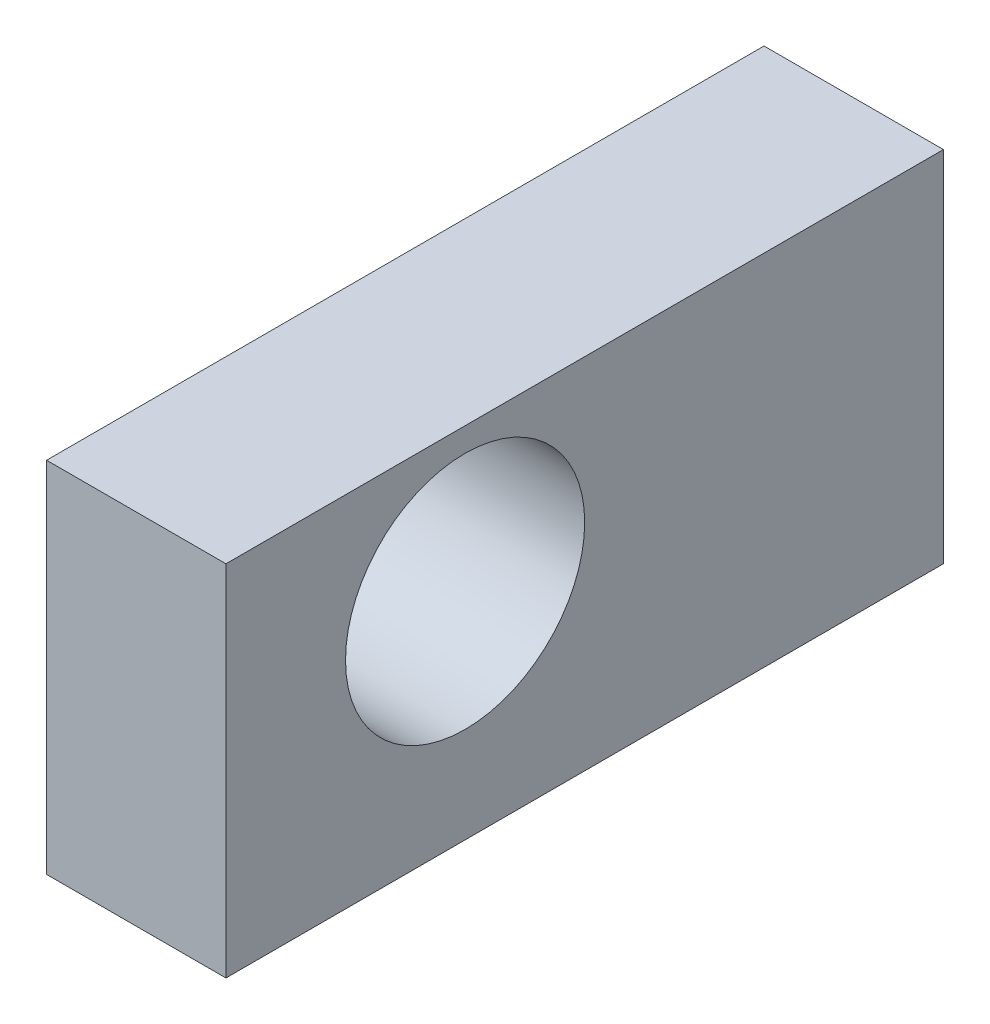
from build123d import *

# Parameters (mm, degrees)
SKETCH1_W                      = 38.1
SKETCH1_H                      = 19.05
BOSS_EXTRUDE1_DEPTH            = 9.525
F_1_2_0_5_DIAMETER_HOLE1_D     = 12.7
F_1_2_0_5_DIAMETER_HOLE1_DEPTH = 70.104
F_1_2_0_5_DIAMETER_HOLE1_TIP   = 3.815464931
F_10_32_TAPPED_HOLE1_D         = 4.0386
F_10_32_TAPPED_HOLE1_DEPTH     = 11.938
F_10_32_TAPPED_HOLE1_TIP       = 1.213317848


with BuildPart() as part:
    # Sketch1 → Boss-Extrude1 (new body)
    with BuildSketch(Plane(origin=(0, 0, 0), x_dir=(0, 0, -1), z_dir=(1, 0, 0))):
        Rectangle(SKETCH1_W, SKETCH1_H)
    extrude(amount=BOSS_EXTRUDE1_DEPTH)

    # 1/2 (0.5) Diameter Hole1
    with Locations(Plane(origin=(9.525, 0, 0), x_dir=(0, 0, -1), z_dir=(1, 0, 0))):
        with Locations((-6.35, 1.905)):
            Hole(F_1_2_0_5_DIAMETER_HOLE1_D / 2, depth=F_1_2_0_5_DIAMETER_HOLE1_DEPTH)
            with Locations((0, 0, -(F_1_2_0_5_DIAMETER_HOLE1_DEPTH + F_1_2_0_5_DIAMETER_HOLE1_TIP / 2))):  # 118° drill point
                Cone(0, F_1_2_0_5_DIAMETER_HOLE1_D / 2, F_1_2_0_5_DIAMETER_HOLE1_TIP, mode=Mode.SUBTRACT)

    # #10-32 Tapped Hole1
    with Locations(Plane(origin=(-1.136463696, 0.51181849, -19.05), x_dir=(-1, 0, 0), z_dir=(0, 0, -1))):
        with Locations((-5.898963696, -3.68681849), (-5.898963696, 5.20318151)):
            Hole(F_10_32_TAPPED_HOLE1_D / 2, depth=F_10_32_TAPPED_HOLE1_DEPTH)
            with Locations((0, 0, -(F_10_32_TAPPED_HOLE1_DEPTH + F_10_32_TAPPED_HOLE1_TIP / 2))):  # 118° drill point
                Cone(0, F_10_32_TAPPED_HOLE1_D / 2, F_10_32_TAPPED_HOLE1_TIP, mode=Mode.SUBTRACT)


solid = part.part
